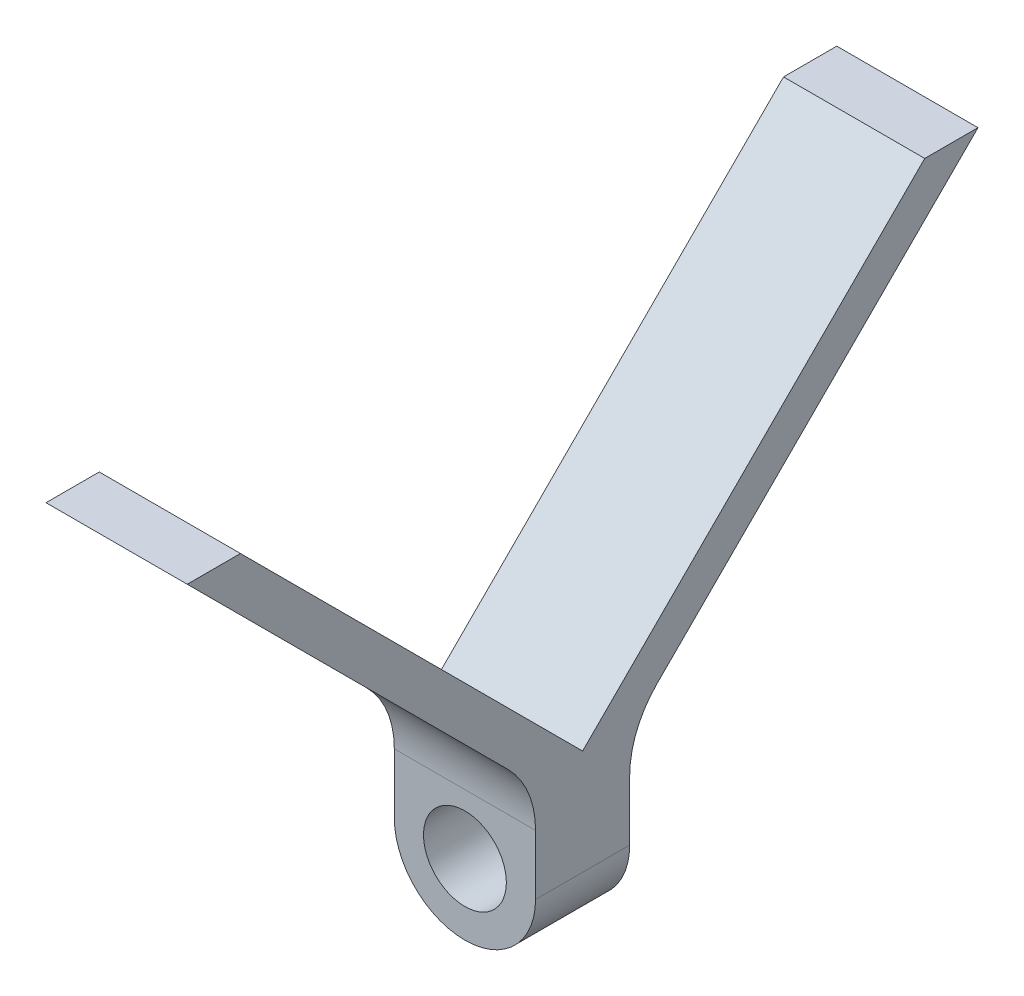
from build123d import *

# Parameters (mm, degrees)
BOSS_EXTRUDE1_DEPTH             = 2.5
BOSS_EXTRUDE2_REACH             = 7.863
BOSS_EXTRUDE2_DIRECTION_2_REACH = 7.863
CUT_EXTRUDE2_DEPTH              = 33.577791515
CUT_EXTRUDE2_DEPTH_BACK         = 33.577791515
SKETCH5_W                       = 5
SKETCH5_H                       = 1.5
BOSS_EXTRUDE3_DEPTH             = 7.5
SKETCH6_R                       = 2.2
CUT_EXTRUDE4_DEPTH              = 10
FILLET1_R                       = 5


with BuildPart() as part:
    # Sketch1 → Boss-Extrude1 (new, symmetric)
    with BuildSketch(Plane.XY):
        with BuildLine():
            Line((-3.75, 0), (-3.75, 3.75))
            Line((-3.75, 3.75), (3.75, 3.75))
            Line((3.75, 3.75), (3.75, 0))
            ThreePointArc((3.75, 0), (0, -3.75), (-3.75, 0))
        make_face()
    extrude(amount=BOSS_EXTRUDE1_DEPTH, both=True)

    # Boss-Extrude2: up to this face of the body (flat: up to its plane)
    boss_extrude2_end = Plane(part.part.faces().sort_by_distance((3.75, 1.875, 0))[0])
    # Sketch3 → Boss-Extrude2 (add, up to the picked face)
    with BuildSketch(Plane(origin=(0, 0, 0), x_dir=(0, 0, -1), z_dir=(1, 0, 0)), mode=Mode.PRIVATE) as boss_extrude2_sk1:
        Polygon((0, 2.75), (21, 23.75), (-21, 23.75), align=None)
    boss_extrude2_tool1 = split(extrude(boss_extrude2_sk1.sketch, amount=BOSS_EXTRUDE2_REACH, mode=Mode.PRIVATE), bisect_by=boss_extrude2_end, keep=Keep.BOTH, mode=Mode.PRIVATE)
    add(boss_extrude2_tool1.solids().sort_by(Axis((0, 16.75, 0), (1, 0, 0)))[0])

    # Boss-Extrude2 direction 2: up to this face of the body (flat: up to its plane)
    boss_extrude2_direction_2_end = Plane(part.part.faces().sort_by_distance((-3.75, 1.875, 0))[0])
    # Sketch3 → Boss-Extrude2 direction 2 (add, up to the picked face)
    with BuildSketch(Plane(origin=(0, 0, 0), x_dir=(0, 0, -1), z_dir=(1, 0, 0)), mode=Mode.PRIVATE) as boss_extrude2_direction_2_sk1:
        Polygon((0, 2.75), (21, 23.75), (-21, 23.75), align=None)
    boss_extrude2_direction_2_tool1 = split(extrude(boss_extrude2_direction_2_sk1.sketch, amount=-BOSS_EXTRUDE2_DIRECTION_2_REACH, mode=Mode.PRIVATE), bisect_by=boss_extrude2_direction_2_end, keep=Keep.BOTH, mode=Mode.PRIVATE)
    add(boss_extrude2_direction_2_tool1.solids().sort_by(Axis((0, 16.75, 0), (-1, 0, 0)))[0])

    # Sketch4 → Cut-Extrude2 (cut, two sides: drawn at the far end of the back side and taken through both)
    with BuildSketch(Plane(origin=(3.75, 0, 0), x_dir=(0, 0, -1), z_dir=(1, 0, 0)).offset(-CUT_EXTRUDE2_DEPTH_BACK)):
        Polygon((-18.171572875, 23.75), (0, 5.578427125), (18.171572875, 23.75), align=None)
    extrude(amount=CUT_EXTRUDE2_DEPTH + CUT_EXTRUDE2_DEPTH_BACK, mode=Mode.SUBTRACT)

    # Sketch5 → Boss-Extrude3 (add)
    with BuildSketch(Plane(origin=(3.75, 0, 0), x_dir=(0, 0, -1), z_dir=(1, 0, 0))):
        with Locations((0, 4.5)):
            Rectangle(SKETCH5_W, SKETCH5_H)
    extrude(amount=-BOSS_EXTRUDE3_DEPTH)

    # Sketch6 → Cut-Extrude4 (cut)
    with BuildSketch(Plane.XY.offset(2.5)):
        Circle(SKETCH6_R)
    extrude(amount=-CUT_EXTRUDE4_DEPTH, mode=Mode.SUBTRACT)

    # Fillet1
    fillet1_edges = [part.edges().sort_by_distance(p)[0] for p in [
        (0, 5.25, 2.5),
        (0, 5.25, -2.5),
    ]]
    fillet(fillet1_edges, radius=FILLET1_R)


solid = part.part
